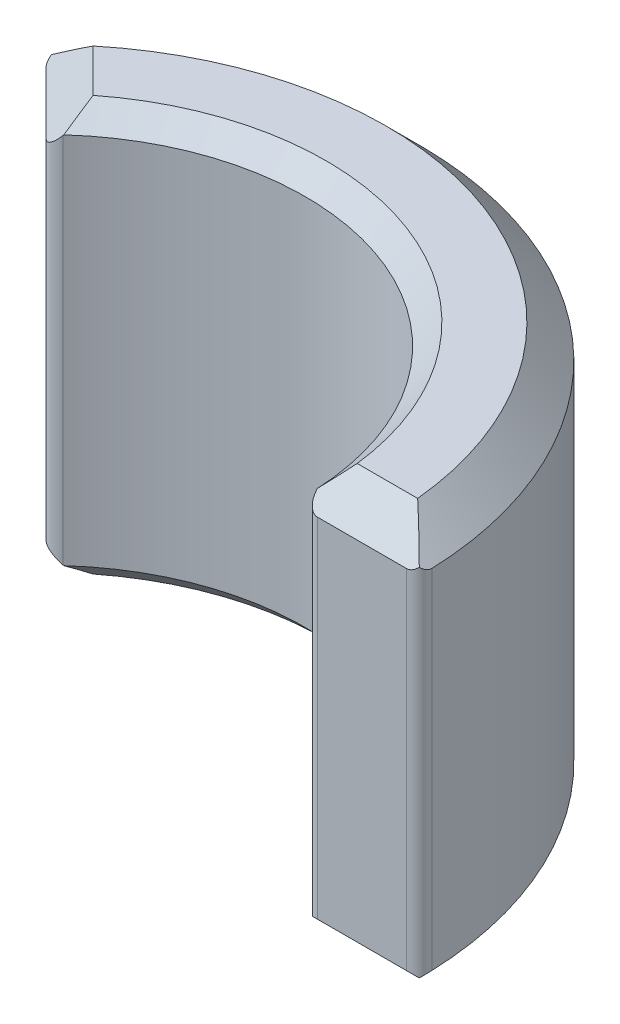
from build123d import *

# Parameters (mm, degrees)
BOSS_EXTRUDE1_DEPTH = 12.7
CHAMFER1_SIZE       = 1.016
CHAMFER2_SIZE       = 0.635
FILLET1_R           = 0.381


with BuildPart() as part:
    # Sketch1 → Boss-Extrude1 (new body)
    with BuildSketch(Plane(origin=(0, 0, 0), x_dir=(1, 0, 0), z_dir=(0, 1, 0))):
        with BuildLine():
            ThreePointArc((-5.612660076, 5.612660076), (3.037549744, 7.333293789), (7.9375, 0))
            Line((7.9375, 0), (11.43, 0))
            ThreePointArc((11.43, 0), (4.374071632, 10.559943057), (-8.082230509, 8.082230509))
            Line((-8.082230509, 8.082230509), (-5.612660076, 5.612660076))
        make_face()
    extrude(amount=BOSS_EXTRUDE1_DEPTH)

    # Chamfer1
    chamfer1_edges = [part.edges().sort_by_distance(p)[0] for p in [
        (-6.847445292, 12.7, -6.847445292),
        (9.68375, 12.7, 0),
        (-6.847445292, 0, -6.847445292),
        (4.374071632, 0, -10.559943057),
        (9.68375, 0, 0),
        (4.374071632, 12.7, -10.559943057),
    ]]
    chamfer(chamfer1_edges, length=CHAMFER1_SIZE)

    # Chamfer2
    chamfer2_edges = [part.edges().sort_by_distance(p)[0] for p in [
        (3.037549744, 0, -7.333293789),
        (3.037549744, 12.7, -7.333293789),
    ]]
    chamfer(chamfer2_edges, length=CHAMFER2_SIZE)

    # Fillet1
    fillet1_edges = [part.edges().sort_by_distance(p)[0] for p in [
        (7.9375, 6.35, 0),
        (11.43, 6.35, 0),
        (-8.082230509, 6.35, -8.082230509),
        (-5.612660076, 6.35, -5.612660076),
    ]]
    fillet(fillet1_edges, radius=FILLET1_R)


solid = part.part
